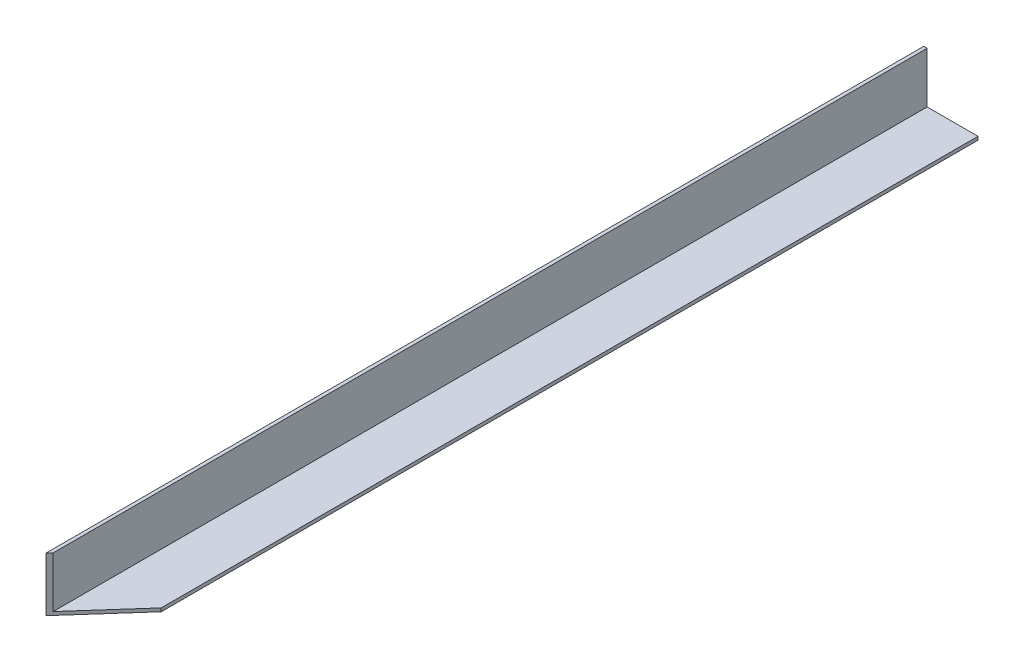
from build123d import *

# Parameters (mm, degrees)
EXTRUDE_THIN1_DEPTH = 259
CUT_EXTRUDE1_DEPTH  = 260.926912804


with BuildPart() as part:
    # Sketch1 → Extrude-Thin1 (new body)
    with BuildSketch(Plane.XY):
        Polygon((15, 0), (0, 0), (0, 15), (-1, 15), (-1, -1), (15, -1), align=None)
    extrude(amount=EXTRUDE_THIN1_DEPTH)

    # Sketch2 → Cut-Extrude1 (cut, through all)
    with BuildSketch(Plane(origin=(0, -1, 0), x_dir=(-1, 0, 0), z_dir=(0, -1, 0))):
        Polygon((1, -259), (-15, -241), (-15, -259), align=None)
    extrude(amount=-CUT_EXTRUDE1_DEPTH, mode=Mode.SUBTRACT)


solid = part.part
